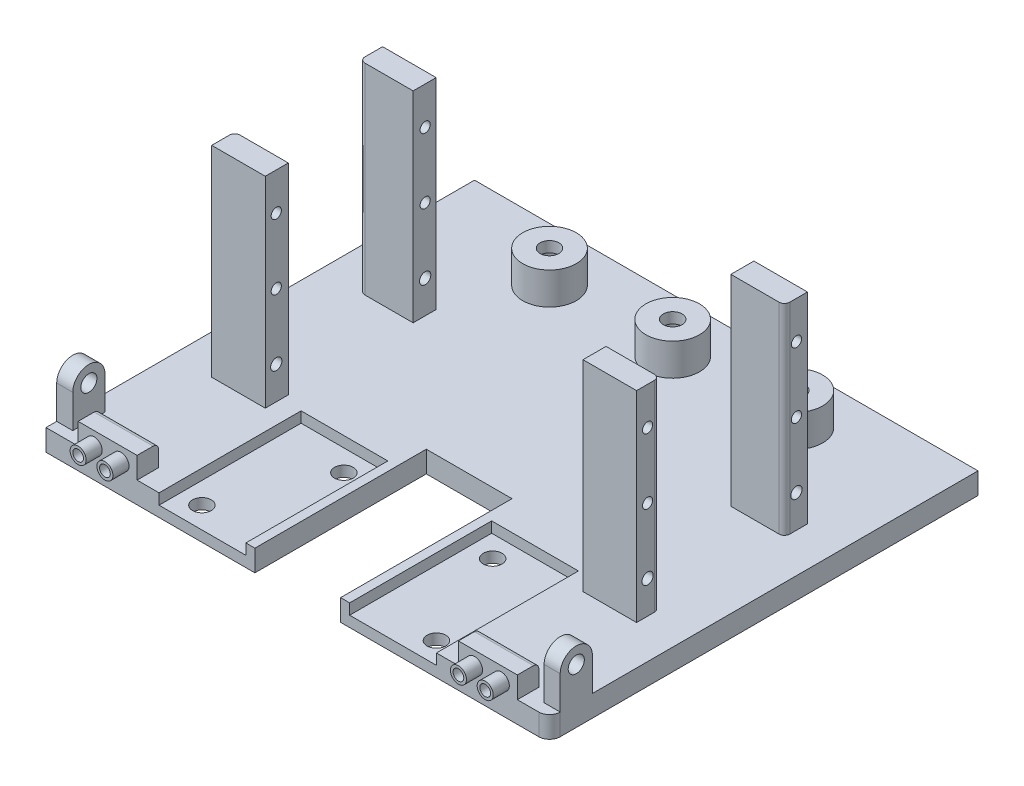
from build123d import *

# Parameters (mm, degrees)
SKETCH_1_W             = 102
SKETCH_1_H             = 80
EXTRUDE_1_DEPTH        = 4
SKETCH_5_R             = 1.505
EXTRUDE_3_DEPTH        = 3
SKETCH_16_W            = 10
SKETCH_16_H            = 4.3
EXTRUDE_6_DEPTH        = 37.5
FILLET_3_R             = 1
SKETCH_17_R            = 1.05
SKETCH_17_R_2          = 0.95
CUT_EXTRUDE_10_DEPTH   = 12.5
SKETCH_18_W            = 102
SKETCH_18_H            = 10
CUT_EXTRUDE_11_DEPTH   = 12.5
FILLET_3_OF_MIRROR_2_R = 1
SKETCH_21_W            = 5.636629149
SKETCH_21_H            = 7.556578014
CUT_EXTRUDE_14_DEPTH   = 97.037752993
FILLET_7_R             = 2
SKETCH_22_W            = 16.2
SKETCH_22_H            = 26.510678642
CUT_EXTRUDE_15_DEPTH   = 2
SKETCH_23_R            = 1.75
CUT_EXTRUDE_16_DEPTH   = 74.275166389
SKETCH_25_W            = 11
SKETCH_25_H            = 4
SKETCH_25_R            = 1
EXTRUDE_7_DEPTH        = 4
EXTRUDE_START          = 3
SKETCH_27_R            = 1.5
SKETCH_27_R_2          = 1
EXTRUDE_8_DEPTH        = 3
FILLET_8_R             = 1
FILLET_8_OF_MIRROR_7_R = 1
SKETCH_28_W            = 16
SKETCH_28_H            = 32
CUT_EXTRUDE_17_DEPTH   = 10
SKETCH_29_W            = 94
SKETCH_29_H            = 4
EXTRUDE_9_DEPTH        = 10
SKETCH_30_R            = 5
EXTRUDE_10_DEPTH       = 10
SKETCH_31_R            = 3.5
CUT_EXTRUDE_18_DEPTH   = 8
SKETCH_32_R            = 1.75
CUT_EXTRUDE_19_DEPTH   = 8


with BuildPart() as part:
    # 草图1 → 凸台-拉伸1 (new body)
    with BuildSketch(Plane(origin=(0, 0, 0), x_dir=(1, 0, 0), z_dir=(0, 1, 0))):
        Rectangle(SKETCH_1_W, SKETCH_1_H)
    extrude(amount=EXTRUDE_1_DEPTH)

    # 草图5 → 凸台-拉伸3 (add)
    with BuildSketch(Plane(origin=(44, 0, 0), x_dir=(0, 0, -1), z_dir=(1, 0, 0))):
        with BuildLine():
            Line((-28.004232899, 10.2), (-28.004232899, 4))
            Line((-28.004232899, 4), (-21.995767101, 4))
            Line((-21.995767101, 4), (-21.995767101, 10.2))
            ThreePointArc((-21.995767101, 10.2), (-25, 13.204232899), (-28.004232899, 10.2))
        make_face()
        with Locations((-25, 10.2)):
            Circle(SKETCH_5_R, mode=Mode.SUBTRACT)
    extrude_3 = extrude(amount=EXTRUDE_3_DEPTH)

    # 镜向1: 凸台-拉伸3 across plane
    add(extrude_3.mirror(Plane(origin=(0, 0, 0), x_dir=(0, 0, 1), z_dir=(1, 0, 0))))

    # 草图16 → 凸台-拉伸6 (add)
    with BuildSketch(Plane(origin=(0, 4, 0), x_dir=(1, 0, 0), z_dir=(0, 1, 0))):
        with Locations((34.66, -4.250125)):
            Rectangle(SKETCH_16_W, SKETCH_16_H)
        with Locations((34.66, 23.349875)):
            Rectangle(SKETCH_16_W, SKETCH_16_H)
    extrude_6 = extrude(amount=EXTRUDE_6_DEPTH)

    # 圆角3
    fillet_3_edges = [part.edges().sort_by_distance(p)[0] for p in [
        (39.66, 22.75, 2.100125),
        (39.66, 22.75, -21.199875),
    ]]
    fillet(fillet_3_edges, radius=FILLET_3_R)

    # 草图17 → 切除-拉伸10 (cut)
    with BuildSketch(Plane(origin=(39.66, 0, 0), x_dir=(0, 0, -1), z_dir=(1, 0, 0))):
        with Locations((-4.350125, 10.1)):
            Circle(SKETCH_17_R)
        with Locations((23.449875, 10.1)):
            Circle(SKETCH_17_R)
        with Locations((23.449875, 22.3)):
            Circle(SKETCH_17_R_2)
        with Locations((23.449875, 34.5)):
            Circle(SKETCH_17_R_2)
        with Locations((-4.350125, 34.5)):
            Circle(SKETCH_17_R_2)
        with Locations((-4.350125, 22.3)):
            Circle(SKETCH_17_R_2)
    cut_extrude_10 = extrude(amount=-CUT_EXTRUDE_10_DEPTH, mode=Mode.SUBTRACT)

    # 草图18 → 切除-拉伸11 (cut)
    with BuildSketch(Plane(origin=(0, 4, 0), x_dir=(1, 0, 0), z_dir=(0, 1, 0))):
        with Locations((0, -35)):
            Rectangle(SKETCH_18_W, SKETCH_18_H)
    extrude(amount=-CUT_EXTRUDE_11_DEPTH, mode=Mode.SUBTRACT)

    # 镜向2: 凸台-拉伸6, 切除-拉伸10 across plane
    add(extrude_6.mirror(Plane(origin=(0, 0, 0), x_dir=(0, 0, 1), z_dir=(1, 0, 0))))
    add(cut_extrude_10.mirror(Plane(origin=(0, 0, 0), x_dir=(0, 0, 1), z_dir=(1, 0, 0))), mode=Mode.SUBTRACT)

    # 圆角3 of 镜向2
    fillet_3_of_mirror_2_edges = [part.edges().sort_by_distance(p)[0] for p in [
        (-39.66, 22.75, 2.100125),
        (-39.66, 22.75, -21.199875),
    ]]
    fillet(fillet_3_of_mirror_2_edges, radius=FILLET_3_OF_MIRROR_2_R)

    # 草图21 → 切除-拉伸14 (cut, through all)
    with BuildSketch(Plane.XY.offset(30)):
        with Locations((49.818314575, 1.602871311)):
            Rectangle(SKETCH_21_W, SKETCH_21_H)
    cut_extrude_14 = extrude(amount=-CUT_EXTRUDE_14_DEPTH, mode=Mode.SUBTRACT)

    # 镜向5: 切除-拉伸14 across plane
    add(cut_extrude_14.mirror(Plane(origin=(0, 0, 0), x_dir=(0, 0, 1), z_dir=(1, 0, 0))), mode=Mode.SUBTRACT)

    # 圆角7
    fillet_7_edges = [part.edges().sort_by_distance(p)[0] for p in [
        (47, 2, 30),
    ]]
    fillet(fillet_7_edges, radius=FILLET_7_R)

    # 草图22 → 切除-拉伸15 (cut)
    with BuildSketch(Plane(origin=(0, 4, 0), x_dir=(1, 0, 0), z_dir=(0, 1, 0))):
        with Locations((17.79, -16.744660679)):
            Rectangle(SKETCH_22_W, SKETCH_22_H)
    cut_extrude_15 = extrude(amount=-CUT_EXTRUDE_15_DEPTH, mode=Mode.SUBTRACT)

    # 草图23 → 切除-拉伸16 (cut, through all)
    with BuildSketch(Plane(origin=(0, 2, 0), x_dir=(1, 0, 0), z_dir=(0, 1, 0))):
        with Locations(Location((13.89, -7.5, 0), (0, 0, 270))):
            Circle(SKETCH_23_R)
        with Locations(Location((21.89, -26, 0), (0, 0, 270))):
            Circle(SKETCH_23_R)
    cut_extrude_16 = extrude(amount=-CUT_EXTRUDE_16_DEPTH, mode=Mode.SUBTRACT)

    # 镜向6: 切除-拉伸15, 切除-拉伸16 across plane
    add(cut_extrude_15.mirror(Plane(origin=(0, 0, 0), x_dir=(0, 0, 1), z_dir=(1, 0, 0))), mode=Mode.SUBTRACT)
    add(cut_extrude_16.mirror(Plane(origin=(0, 0, 0), x_dir=(0, 0, 1), z_dir=(1, 0, 0))), mode=Mode.SUBTRACT)

    # 草图25 → 凸台-拉伸7 (add)
    with BuildSketch(Plane.XY.offset(30)):
        with Locations((-35.5, 6)):
            Rectangle(SKETCH_25_W, SKETCH_25_H)
        with Locations((-38, 5.5)):
            Circle(SKETCH_25_R, mode=Mode.SUBTRACT)
        with Locations((-33, 5.5)):
            Circle(SKETCH_25_R, mode=Mode.SUBTRACT)
    extrude_7 = extrude(amount=-EXTRUDE_7_DEPTH)

    # 草图27 → 凸台-拉伸8 (add)
    # profile 1 of 2: a face of its own
    with BuildSketch(Plane.XY.offset(30).offset(EXTRUDE_START)):
        with Locations(Location((-38, 5.5, 0), (0, 0, 180))):
            Circle(SKETCH_27_R)
        with Locations((-38, 5.5)):
            Circle(SKETCH_27_R_2, mode=Mode.SUBTRACT)
    # profile 2 of 2: a face of its own
    with BuildSketch(Plane.XY.offset(30).offset(EXTRUDE_START)):
        with Locations(Location((-33, 5.5, 0), (0, 0, 180))):
            Circle(SKETCH_27_R)
        with Locations((-33, 5.5)):
            Circle(SKETCH_27_R_2, mode=Mode.SUBTRACT)
    extrude_8 = extrude(amount=-EXTRUDE_8_DEPTH)

    # 圆角8
    fillet_8_edges = [part.edges().sort_by_distance(p)[0] for p in [
        (-35.5, 8, 26),
    ]]
    fillet(fillet_8_edges, radius=FILLET_8_R)

    # 镜向7: 凸台-拉伸7, 凸台-拉伸8 across plane
    add(extrude_7.mirror(Plane(origin=(0, 0, 0), x_dir=(0, 0, 1), z_dir=(1, 0, 0))))
    add(extrude_8.mirror(Plane(origin=(0, 0, 0), x_dir=(0, 0, 1), z_dir=(1, 0, 0))))

    # 圆角8 of 镜向7
    fillet_8_of_mirror_7_edges = [part.edges().sort_by_distance(p)[0] for p in [
        (35.5, 8, 26),
    ]]
    fillet(fillet_8_of_mirror_7_edges, radius=FILLET_8_OF_MIRROR_7_R)

    # 草图28 → 切除-拉伸17 (cut)
    with BuildSketch(Plane.XZ):
        with Locations((0, 14)):
            Rectangle(SKETCH_28_W, SKETCH_28_H)
    extrude(amount=-CUT_EXTRUDE_17_DEPTH, mode=Mode.SUBTRACT)

    # 草图29 → 凸台-拉伸9 (add)
    with BuildSketch(Plane(origin=(0, 0, -40), x_dir=(-1, 0, 0), z_dir=(0, 0, -1))):
        with Locations((0, 2)):
            Rectangle(SKETCH_29_W, SKETCH_29_H)
    extrude(amount=EXTRUDE_9_DEPTH)

    # 草图30 → 凸台-拉伸10 (add)
    with BuildSketch(Plane.XZ):
        with Locations(Location((-23, -40, 0), (0, 0, 270))):
            Circle(SKETCH_30_R)
        with Locations(Location((0, -40, 0), (0, 0, 270))):
            Circle(SKETCH_30_R)
        with Locations(Location((23, -40, 0), (0, 0, 270))):
            Circle(SKETCH_30_R)
    extrude(amount=-EXTRUDE_10_DEPTH)

    # 草图31 → 切除-拉伸18 (cut)
    with BuildSketch(Plane.XZ):
        with Locations(Location((23, -40, 0), (0, 0, 270))):
            Circle(SKETCH_31_R)
        with Locations(Location((-23, -40, 0), (0, 0, 270))):
            Circle(SKETCH_31_R)
        with Locations(Location((0, -40, 0), (0, 0, 270))):
            Circle(SKETCH_31_R)
    extrude(amount=-CUT_EXTRUDE_18_DEPTH, mode=Mode.SUBTRACT)

    # 草图32 → 切除-拉伸19 (cut)
    with BuildSketch(Plane(origin=(0, 10, 0), x_dir=(1, 0, 0), z_dir=(0, 1, 0))):
        with Locations(Location((0, 40, 0), (0, 0, 270))):
            Circle(SKETCH_32_R)
        with Locations(Location((23, 40, 0), (0, 0, 270))):
            Circle(SKETCH_32_R)
        with Locations(Location((-23, 40, 0), (0, 0, 270))):
            Circle(SKETCH_32_R)
    extrude(amount=-CUT_EXTRUDE_19_DEPTH, mode=Mode.SUBTRACT)


solid = part.part
